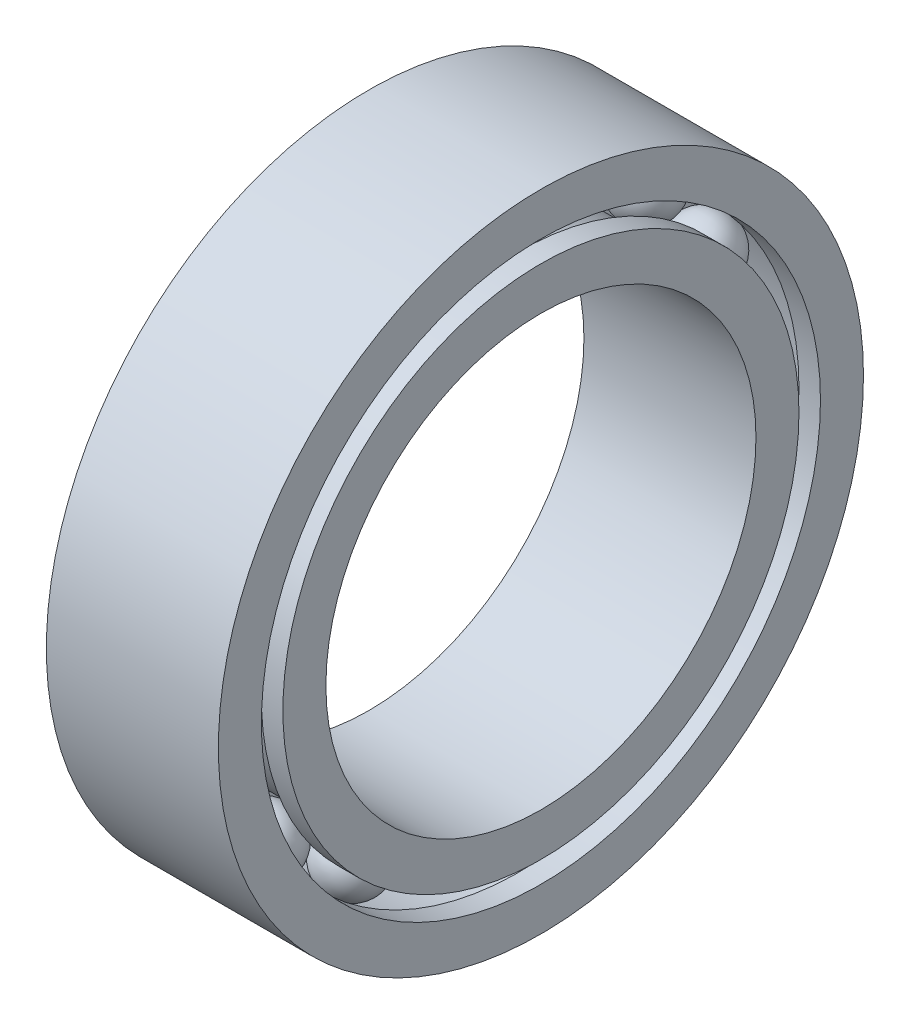
from build123d import *

# Parameters (mm, degrees)
EXTRUDE_1_DEPTH          = 2
EXTRUDE_1_DEPTH_BACK     = 2
SKETCH_1_4_R             = 5.5
SKETCH_1_4_R_2           = 5
EXTRUDE_1_2_DEPTH        = 2
EXTRUDE_1_2_DEPTH_BACK   = 2
SKETCH_1_4_R_3           = 7.5
SKETCH_1_4_R_4           = 7
PATTERN_CIRCULAR_6_COUNT = 16
SKETCH_2_R               = 7
SKETCH_2_R_2             = 6.5
SKETCH_2_R_3             = 6
SKETCH_2_R_4             = 5.5
EXTRUDE_2_DEPTH          = 0.5
SKETCH_3_R               = 7
SKETCH_3_R_2             = 6.5
SKETCH_3_R_3             = 6
SKETCH_3_R_4             = 5.5
EXTRUDE_3_DEPTH          = 0.5


with BuildPart() as part:
    # 草图1 → 旋转1 (revolve)
    with BuildSketch(Plane(origin=(0, 0, 0), x_dir=(0, 0, -1), z_dir=(1, 0, 0))):
        with BuildLine():
            Line((0, 7), (0, 5.5))
            ThreePointArc((0, 5.5), (0.75, 6.25), (0, 7))
        make_face()
    revolve(axis=Axis((0, 7, 0), (0, -1, 0)))


with BuildPart() as body_2:
    # 草图1<4> → 凸台-拉伸1 (new, two sides: drawn at the far end of the back side and taken through both)
    with BuildSketch(Plane(origin=(0, 0, 0), x_dir=(0, 0, -1), z_dir=(1, 0, 0)).offset(-EXTRUDE_1_DEPTH_BACK)):
        Circle(SKETCH_1_4_R)
        Circle(SKETCH_1_4_R_2, mode=Mode.SUBTRACT)
    extrude(amount=EXTRUDE_1_DEPTH + EXTRUDE_1_DEPTH_BACK)



with BuildPart() as body_3:
    # 草图1<4> → Extrude 1 2 (new, two sides: drawn at the far end of the back side and taken through both)
    with BuildSketch(Plane(origin=(0, 0, 0), x_dir=(0, 0, -1), z_dir=(1, 0, 0)).offset(-EXTRUDE_1_2_DEPTH_BACK)):
        Circle(SKETCH_1_4_R_3)
        Circle(SKETCH_1_4_R_4, mode=Mode.SUBTRACT)
    extrude(amount=EXTRUDE_1_2_DEPTH + EXTRUDE_1_2_DEPTH_BACK)


with BuildPart() as pattern_circular_6_1:
    # 阵列(圆周)6: pattern copy
    add(part.part.rotate(Axis((2, 0, 0), (1, 0, 0)), 1 * 360 / PATTERN_CIRCULAR_6_COUNT))


with BuildPart() as pattern_circular_6_2:
    # 阵列(圆周)6: pattern copy
    add(part.part.rotate(Axis((2, 0, 0), (1, 0, 0)), 2 * 360 / PATTERN_CIRCULAR_6_COUNT))


with BuildPart() as pattern_circular_6_3:
    # 阵列(圆周)6: pattern copy
    add(part.part.rotate(Axis((2, 0, 0), (1, 0, 0)), 3 * 360 / PATTERN_CIRCULAR_6_COUNT))


with BuildPart() as pattern_circular_6_4:
    # 阵列(圆周)6: pattern copy
    add(part.part.rotate(Axis((2, 0, 0), (1, 0, 0)), 4 * 360 / PATTERN_CIRCULAR_6_COUNT))


with BuildPart() as pattern_circular_6_5:
    # 阵列(圆周)6: pattern copy
    add(part.part.rotate(Axis((2, 0, 0), (1, 0, 0)), 5 * 360 / PATTERN_CIRCULAR_6_COUNT))


with BuildPart() as pattern_circular_6_6:
    # 阵列(圆周)6: pattern copy
    add(part.part.rotate(Axis((2, 0, 0), (1, 0, 0)), 6 * 360 / PATTERN_CIRCULAR_6_COUNT))


with BuildPart() as pattern_circular_6_7:
    # 阵列(圆周)6: pattern copy
    add(part.part.rotate(Axis((2, 0, 0), (1, 0, 0)), 7 * 360 / PATTERN_CIRCULAR_6_COUNT))


with BuildPart() as pattern_circular_6_8:
    # 阵列(圆周)6: pattern copy
    add(part.part.rotate(Axis((2, 0, 0), (1, 0, 0)), 8 * 360 / PATTERN_CIRCULAR_6_COUNT))


with BuildPart() as pattern_circular_6_9:
    # 阵列(圆周)6: pattern copy
    add(part.part.rotate(Axis((2, 0, 0), (1, 0, 0)), 9 * 360 / PATTERN_CIRCULAR_6_COUNT))


with BuildPart() as pattern_circular_6_10:
    # 阵列(圆周)6: pattern copy
    add(part.part.rotate(Axis((2, 0, 0), (1, 0, 0)), 10 * 360 / PATTERN_CIRCULAR_6_COUNT))


with BuildPart() as pattern_circular_6_11:
    # 阵列(圆周)6: pattern copy
    add(part.part.rotate(Axis((2, 0, 0), (1, 0, 0)), 11 * 360 / PATTERN_CIRCULAR_6_COUNT))


with BuildPart() as pattern_circular_6_12:
    # 阵列(圆周)6: pattern copy
    add(part.part.rotate(Axis((2, 0, 0), (1, 0, 0)), 12 * 360 / PATTERN_CIRCULAR_6_COUNT))


with BuildPart() as pattern_circular_6_13:
    # 阵列(圆周)6: pattern copy
    add(part.part.rotate(Axis((2, 0, 0), (1, 0, 0)), 13 * 360 / PATTERN_CIRCULAR_6_COUNT))


with BuildPart() as pattern_circular_6_14:
    # 阵列(圆周)6: pattern copy
    add(part.part.rotate(Axis((2, 0, 0), (1, 0, 0)), 14 * 360 / PATTERN_CIRCULAR_6_COUNT))


with BuildPart() as pattern_circular_6_15:
    # 阵列(圆周)6: pattern copy
    add(part.part.rotate(Axis((2, 0, 0), (1, 0, 0)), 15 * 360 / PATTERN_CIRCULAR_6_COUNT))


with BuildPart() as body_2_1:
    add(body_2.part)

    add(body_3.part)  # 凸台-拉伸2 merges body 3
    # 草图2 → 凸台-拉伸2 (add)
    # profile 1 of 2: a face of its own
    with BuildSketch(Plane.ZY.offset(2)):
        Circle(SKETCH_2_R)
        Circle(SKETCH_2_R_2, mode=Mode.SUBTRACT)
    # profile 2 of 2: a face of its own
    with BuildSketch(Plane.ZY.offset(2)):
        Circle(SKETCH_2_R_3)
        Circle(SKETCH_2_R_4, mode=Mode.SUBTRACT)
    extrude(amount=-EXTRUDE_2_DEPTH)

    # 草图3 → 凸台-拉伸3 (add)
    # profile 1 of 2: a face of its own
    with BuildSketch(Plane(origin=(2, 0, 0), x_dir=(0, 0, -1), z_dir=(1, 0, 0))):
        Circle(SKETCH_3_R)
        Circle(SKETCH_3_R_2, mode=Mode.SUBTRACT)
    # profile 2 of 2: a face of its own
    with BuildSketch(Plane(origin=(2, 0, 0), x_dir=(0, 0, -1), z_dir=(1, 0, 0))):
        Circle(SKETCH_3_R_3)
        Circle(SKETCH_3_R_4, mode=Mode.SUBTRACT)
    extrude(amount=-EXTRUDE_3_DEPTH)


solid = Compound([part.part, pattern_circular_6_1.part, pattern_circular_6_2.part, pattern_circular_6_3.part, pattern_circular_6_4.part, pattern_circular_6_5.part, pattern_circular_6_6.part, pattern_circular_6_7.part, pattern_circular_6_8.part, pattern_circular_6_9.part, pattern_circular_6_10.part, pattern_circular_6_11.part, pattern_circular_6_12.part, pattern_circular_6_13.part, pattern_circular_6_14.part, pattern_circular_6_15.part, body_2_1.part])
